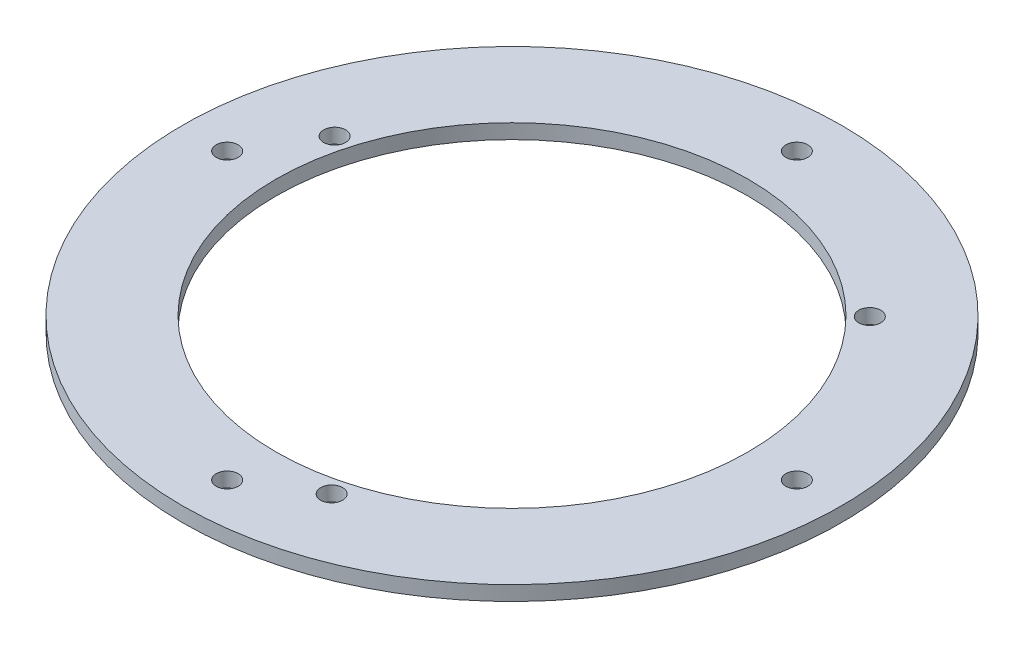
from build123d import *

# Parameters (mm, degrees)
SKETCH2_R           = 1.5
SKETCH2_R_2         = 32.25
BOSS_EXTRUDE1_DEPTH = 2
SKETCH3_R           = 45
CUT_EXTRUDE1_DEPTH  = 74.566296631


with BuildPart() as part:
    # Sketch2 → Boss-Extrude1 (new body)
    with BuildSketch(Plane(origin=(0, 0, 0), x_dir=(1, 0, 0), z_dir=(0, 1, 0))):
        with BuildLine():
            Line((17.897079586, 48.929734976), (40.149284407, 43.651218265))
            ThreePointArc((40.149284407, 43.651218265), (42.540265174, 42.312242187), (43.866371506, 39.91409958))
            Line((43.866371506, 39.91409958), (49.02521675, 17.633846579))
            ThreePointArc((49.02521675, 17.633846579), (49.23478351, 16.809026698), (49.479249782, 15.993868858))
            ThreePointArc((49.479249782, 15.993868858), (51.999812242, -0.139738387), (49.392575566, -16.259565766))
            ThreePointArc((49.392575566, -16.259565766), (49.143731732, -17.073397941), (48.929734976, -17.897079586))
            Line((48.929734976, -17.897079586), (43.651218265, -40.149284407))
            ThreePointArc((43.651218265, -40.149284407), (42.312242187, -42.540265174), (39.91409958, -43.866371506))
            Line((39.91409958, -43.866371506), (17.633846579, -49.02521675))
            ThreePointArc((17.633846579, -49.02521675), (16.809026698, -49.23478351), (15.993868858, -49.479249782))
            ThreePointArc((15.993868858, -49.479249782), (-0.139738387, -51.999812242), (-16.259565766, -49.392575566))
            ThreePointArc((-16.259565766, -49.392575566), (-17.073397941, -49.143731732), (-17.897079586, -48.929734976))
            Line((-17.897079586, -48.929734976), (-40.149284407, -43.651218265))
            ThreePointArc((-40.149284407, -43.651218265), (-42.540265174, -42.312242187), (-43.866371506, -39.91409958))
            Line((-43.866371506, -39.91409958), (-49.02521675, -17.633846579))
            ThreePointArc((-49.02521675, -17.633846579), (-49.23478351, -16.809026698), (-49.479249782, -15.993868858))
            ThreePointArc((-49.479249782, -15.993868858), (-51.999812242, 0.139738387), (-49.392575566, 16.259565766))
            ThreePointArc((-49.392575566, 16.259565766), (-49.143731732, 17.073397941), (-48.929734976, 17.897079586))
            Line((-48.929734976, 17.897079586), (-43.651218265, 40.149284407))
            ThreePointArc((-43.651218265, 40.149284407), (-42.312242187, 42.540265174), (-39.91409958, 43.866371506))
            Line((-39.91409958, 43.866371506), (-17.633846579, 49.02521675))
            ThreePointArc((-17.633846579, 49.02521675), (-16.809026698, 49.23478351), (-15.993868858, 49.479249782))
            ThreePointArc((-15.993868858, 49.479249782), (-8.026622704, 51.3767781), (0.139738387, 51.999812242))
            ThreePointArc((0.139738387, 51.999812242), (8.302633013, 51.332896714), (16.259565766, 49.392575566))
            ThreePointArc((16.259565766, 49.392575566), (17.073397941, 49.143731732), (17.897079586, 48.929734976))
        make_face()
        with Locations(Location((-38.8907, 38.8907, 0), (0, 0, 270))):
            Circle(SKETCH2_R, mode=Mode.SUBTRACT)
        with Locations(Location((38.8907, 38.8907, 0), (0, 0, 90))):
            Circle(SKETCH2_R, mode=Mode.SUBTRACT)
        with Locations(Location((38.8907, -38.8907, 0), (0, 0, 270))):
            Circle(SKETCH2_R, mode=Mode.SUBTRACT)
        with Locations(Location((-38.8907, -38.8907, 0), (0, 0, 90))):
            Circle(SKETCH2_R, mode=Mode.SUBTRACT)
        with Locations(Location((-33.323403491, 9.101105168, 0), (0, 0, 270))):
            Circle(SKETCH2_R, mode=Mode.SUBTRACT)
        with Locations(Location((24.543490023, 24.30836138, 0), (0, 0, 270))):
            Circle(SKETCH2_R, mode=Mode.SUBTRACT)
        with Locations(Location((8.779913467, -33.409466548, 0), (0, 0, 270))):
            Circle(SKETCH2_R, mode=Mode.SUBTRACT)
        with Locations(Location((0, 0, 0), (0, 0, 270))):
            Circle(SKETCH2_R_2, mode=Mode.SUBTRACT)
        with Locations(Location((0, 38.8907, 0), (0, 0, 270))):
            Circle(SKETCH2_R, mode=Mode.SUBTRACT)
        with Locations(Location((38.8907, 0, 0), (0, 0, 270))):
            Circle(SKETCH2_R, mode=Mode.SUBTRACT)
        with Locations(Location((0, -38.8907, 0), (0, 0, 270))):
            Circle(SKETCH2_R, mode=Mode.SUBTRACT)
        with Locations(Location((-38.8907, 0, 0), (0, 0, 270))):
            Circle(SKETCH2_R, mode=Mode.SUBTRACT)
    extrude(amount=BOSS_EXTRUDE1_DEPTH)

    # Sketch3 → Cut-Extrude1 (cut, through all)
    with BuildSketch(Plane(origin=(0, 2, 0), x_dir=(1, 0, 0), z_dir=(0, 1, 0))):
        with BuildLine():
            Line((-43.651218265, 40.149284407), (-48.929734976, 17.897079586))
            ThreePointArc((-48.929734976, 17.897079586), (-49.143731732, 17.073397941), (-49.392575566, 16.259565766))
            ThreePointArc((-49.392575566, 16.259565766), (-51.999812242, 0.139738387), (-49.479249782, -15.993868858))
            ThreePointArc((-49.479249782, -15.993868858), (-49.23478351, -16.809026698), (-49.02521675, -17.633846579))
            Line((-49.02521675, -17.633846579), (-43.866371506, -39.91409958))
            ThreePointArc((-43.866371506, -39.91409958), (-42.540265174, -42.312242187), (-40.149284407, -43.651218265))
            Line((-40.149284407, -43.651218265), (-17.897079586, -48.929734976))
            ThreePointArc((-17.897079586, -48.929734976), (-17.073397941, -49.143731732), (-16.259565766, -49.392575566))
            ThreePointArc((-16.259565766, -49.392575566), (-0.139738387, -51.999812242), (15.993868858, -49.479249782))
            ThreePointArc((15.993868858, -49.479249782), (16.809026698, -49.23478351), (17.633846579, -49.02521675))
            Line((17.633846579, -49.02521675), (39.91409958, -43.866371506))
            ThreePointArc((39.91409958, -43.866371506), (42.312242187, -42.540265174), (43.651218265, -40.149284407))
            Line((43.651218265, -40.149284407), (48.929734976, -17.897079586))
            ThreePointArc((48.929734976, -17.897079586), (49.143731732, -17.073397941), (49.392575566, -16.259565766))
            ThreePointArc((49.392575566, -16.259565766), (51.999812242, -0.139738387), (49.479249782, 15.993868858))
            ThreePointArc((49.479249782, 15.993868858), (49.23478351, 16.809026698), (49.02521675, 17.633846579))
            Line((49.02521675, 17.633846579), (43.866371506, 39.91409958))
            ThreePointArc((43.866371506, 39.91409958), (42.540265174, 42.312242187), (40.149284407, 43.651218265))
            Line((40.149284407, 43.651218265), (17.897079586, 48.929734976))
            ThreePointArc((17.897079586, 48.929734976), (17.073397941, 49.143731732), (16.259565766, 49.392575566))
            ThreePointArc((16.259565766, 49.392575566), (0.139738387, 51.999812242), (-15.993868858, 49.479249782))
            ThreePointArc((-15.993868858, 49.479249782), (-16.809026698, 49.23478351), (-17.633846579, 49.02521675))
            Line((-17.633846579, 49.02521675), (-39.91409958, 43.866371506))
            ThreePointArc((-39.91409958, 43.866371506), (-42.312242187, 42.540265174), (-43.651218265, 40.149284407))
        make_face()
        with Locations(Location((0, 0, 0), (0, 0, 270))):
            Circle(SKETCH3_R, mode=Mode.SUBTRACT)
    extrude(amount=-CUT_EXTRUDE1_DEPTH, mode=Mode.SUBTRACT)


solid = part.part
